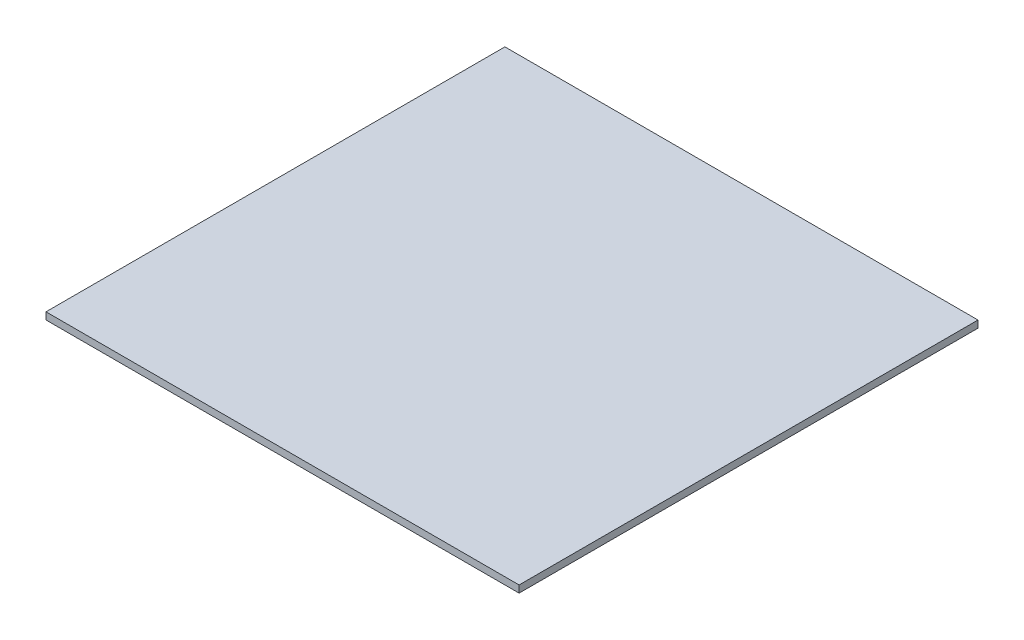
from build123d import *

# Parameters (mm, degrees)
SKETCH1_W           = 200
SKETCH1_H           = 194
BOSS_EXTRUDE1_DEPTH = 3


with BuildPart() as part:
    # Sketch1 → Boss-Extrude1 (new body)
    with BuildSketch(Plane(origin=(0, 0, 0), x_dir=(1, 0, 0), z_dir=(0, 1, 0))):
        with Locations((100, -97)):
            Rectangle(SKETCH1_W, SKETCH1_H)
    extrude(amount=BOSS_EXTRUDE1_DEPTH)


solid = part.part
